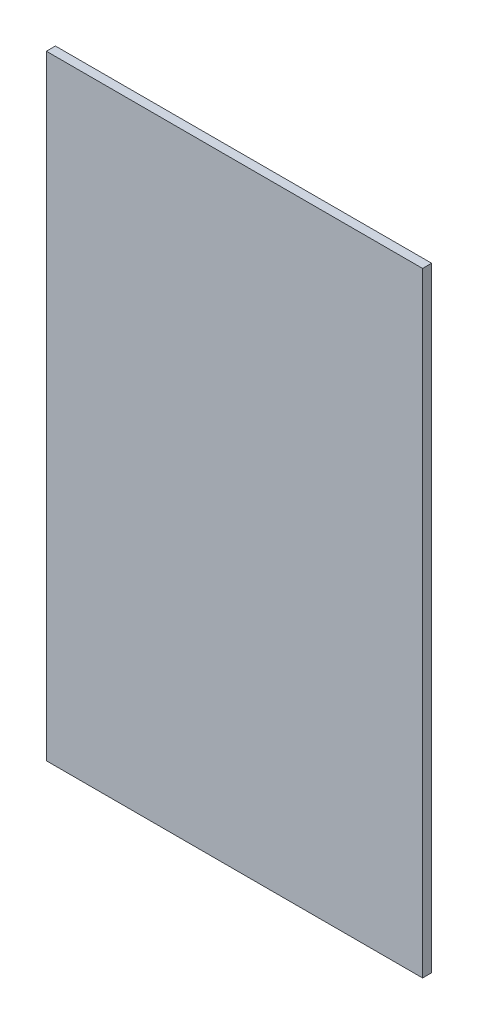
from build123d import *

# Parameters (mm, degrees)
SKETCH_1_W      = 150
SKETCH_1_H      = 245
EXTRUDE_1_DEPTH = 3.6


with BuildPart() as part:
    # 草图1 → 凸台-拉伸1 (new body)
    with BuildSketch(Plane.XY):
        with Locations((10.43814433, -72.048969072)):
            Rectangle(SKETCH_1_W, SKETCH_1_H)
    extrude(amount=EXTRUDE_1_DEPTH)


solid = part.part
